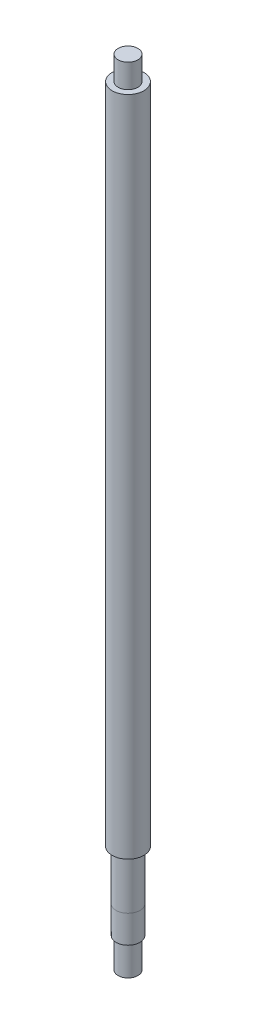
from build123d import *

# Parameters (mm, degrees)
SKETCH1_R        = 8
EXTRUSION1_DEPTH = 400
SKETCH2_R        = 8
EXTRUSION2_DEPTH = 50
EXTRUSION3_START = 50
SKETCH3_R        = 8
EXTRUSION3_DEPTH = 50
SKETCH4_R        = 8
SKETCH4_R_2      = 6
THREAD1_DEPTH    = 14
SKETCH5_R        = 8
SKETCH5_R_2      = 6.05
EXTRUSION5_DEPTH = 25
SKETCH6_R        = 5
EXTRUSION6_DEPTH = 15
EXTRUSION7_START = -27.101
SKETCH7_R        = 8
EXTRUSION7_DEPTH = 27.101
EXTRUSION8_START = 12
SKETCH8_R        = 5
EXTRUSION8_DEPTH = 12


with BuildPart() as part:
    # Sketch1 → Extrusion1 (new body)
    with BuildSketch(Plane(origin=(0, 0, 0), x_dir=(-1, 0, 0), z_dir=(0, 1, 0))):
        with Locations(Location((0, 0, 0), (0, 0, 90))):
            Circle(SKETCH1_R)
    extrude(amount=EXTRUSION1_DEPTH)

    # Sketch2 → Extrusion2 (cut)
    with BuildSketch(Plane.XZ):
        with Locations(Location((0, 0, 0), (0, 0, 270))):
            Circle(SKETCH2_R)
    extrude(amount=-EXTRUSION2_DEPTH, mode=Mode.SUBTRACT)

    # Sketch3 → Extrusion3 (add)
    with BuildSketch(Plane.XZ.offset(-50).offset(EXTRUSION3_START)):
        with Locations(Location((0, 0, 0), (0, 0, 270))):
            Circle(SKETCH3_R)
    extrude(amount=-EXTRUSION3_DEPTH)

    # Sketch4 → Thread1 (cut)
    with BuildSketch(Plane.XZ):
        with Locations(Location((0, 0, 0), (0, 0, 270))):
            Circle(SKETCH4_R)
        with Locations(Location((0, 0, 0), (0, 0, 270))):
            Circle(SKETCH4_R_2, mode=Mode.SUBTRACT)
    extrude(amount=-THREAD1_DEPTH, mode=Mode.SUBTRACT)

    # Sketch5 → Extrusion5 (cut)
    with BuildSketch(Plane.XZ.offset(-14)):
        with Locations(Location((0, 0, 0), (0, 0, 270))):
            Circle(SKETCH5_R)
        with Locations(Location((0, 0, 0), (0, 0, 270))):
            Circle(SKETCH5_R_2, mode=Mode.SUBTRACT)
    extrude(amount=-EXTRUSION5_DEPTH, mode=Mode.SUBTRACT)

    # Sketch6 → Extrusion6 (add)
    with BuildSketch(Plane.XZ):
        with Locations(Location((0, 0, 0), (0, 0, 270))):
            Circle(SKETCH6_R)
    extrude(amount=EXTRUSION6_DEPTH)

    # Sketch7 → Extrusion7 (cut)
    with BuildSketch(Plane(origin=(0, 400, 0), x_dir=(-1, 0, 0), z_dir=(0, 1, 0)).offset(EXTRUSION7_START)):
        with Locations(Location((0, 0, 0), (0, 0, 270))):
            Circle(SKETCH7_R)
    extrude(amount=EXTRUSION7_DEPTH, mode=Mode.SUBTRACT)

    # Sketch8 → Extrusion8 (add)
    with BuildSketch(Plane(origin=(0, 372.899, 0), x_dir=(-1, 0, 0), z_dir=(0, 1, 0)).offset(EXTRUSION8_START)):
        with Locations(Location((0, 0, 0), (0, 0, 270))):
            Circle(SKETCH8_R)
    extrude(amount=-EXTRUSION8_DEPTH)


solid = part.part
